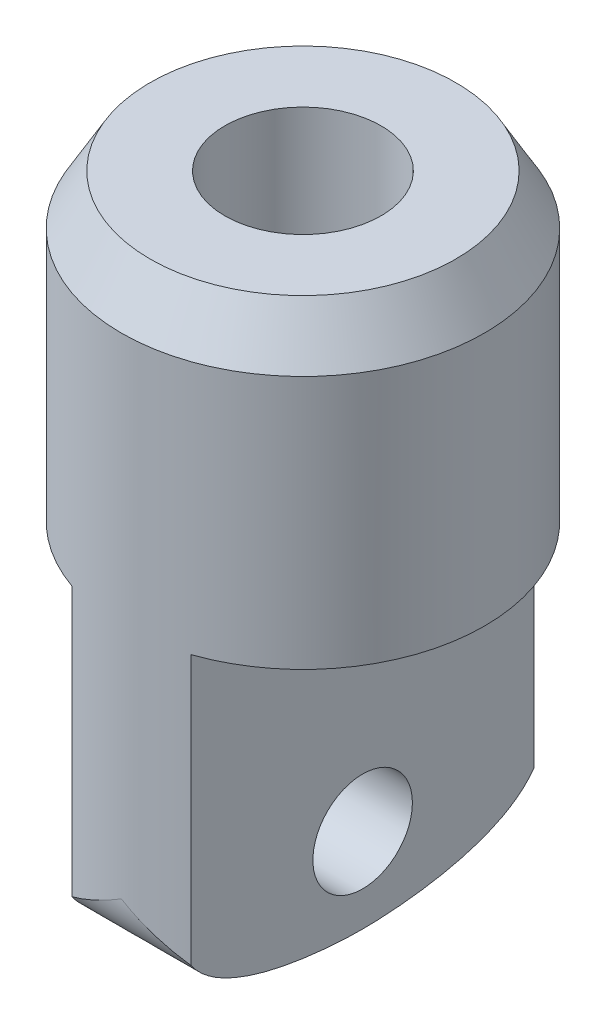
from build123d import *

# Parameters (mm, degrees)
SKETCH3_R                           = 4.6355
BOSS_EXTRUDE1_DEPTH                 = 8.001
SKETCH4_R                           = 1.9939
CUT_EXTRUDE1_DEPTH                  = 5.588
CHAMFER1_SIZE                       = 1.27
CHAMFER1_SIZE2                      = 0.733234842
CUT_EXTRUDE2_REACH                  = 12.344
CUT_EXTRUDE2_END_RADIUS             = 4.6355
SKETCH5_W                           = 3.887671843
SKETCH5_H                           = 8.255
CUT_EXTRUDE2_DIRECTION_2_REACH      = 12.344
CUT_EXTRUDE2_DIRECTION_2_END_RADIUS = 4.6355
CUT_EXTRUDE3_REACH                  = 13.111
CUT_EXTRUDE4_REACH                  = 13.111
SKETCH7_R                           = 1.27


with BuildPart() as part:
    # Sketch3 → Boss-Extrude1 (new, symmetric)
    with BuildSketch(Plane(origin=(0, 0, 0), x_dir=(1, 0, 0), z_dir=(0, 1, 0))):
        with Locations(Location((0, 0, 0), (0, 0, 270))):
            Circle(SKETCH3_R)
    extrude(amount=BOSS_EXTRUDE1_DEPTH, both=True)

    # Sketch4 → Cut-Extrude1 (cut)
    with BuildSketch(Plane(origin=(0, 8.001, 0), x_dir=(1, 0, 0), z_dir=(0, 1, 0))):
        with Locations(Location((0, 0, 0), (0, 0, 270))):
            Circle(SKETCH4_R)
    extrude(amount=-CUT_EXTRUDE1_DEPTH, mode=Mode.SUBTRACT)

    # Chamfer1
    chamfer1_edges = [part.edges().sort_by_distance(p)[0] for p in [
        (0, 8.001, -4.6355),
    ]]
    chamfer1_side = [part.faces().sort_by_distance(p)[0] for p in [
        (0, 0, -4.6355),
    ]]
    chamfer(chamfer1_edges, length=CHAMFER1_SIZE, length2=CHAMFER1_SIZE2, reference=chamfer1_side[0])

    # Cut-Extrude2: up to this cylinder (the profile starts inside it)
    cut_extrude2_end = Plane(origin=(0, -3.8735, 0), z_dir=(0, -1, 0)) * Cylinder(CUT_EXTRUDE2_END_RADIUS, 34.959, mode=Mode.PRIVATE)
    # Sketch5 → Cut-Extrude2 (cut, up to the surface)
    with BuildSketch(Plane.XY, mode=Mode.PRIVATE) as cut_extrude2_sk1:
        with Locations((-3.467835922, -3.8735)):
            Rectangle(SKETCH5_W, SKETCH5_H)
    cut_extrude2_tool1 = extrude(cut_extrude2_sk1.sketch, amount=-CUT_EXTRUDE2_REACH, mode=Mode.PRIVATE) & cut_extrude2_end
    add(cut_extrude2_tool1.solids().sort_by_distance((-3.467836, -3.8735, 0))[0], mode=Mode.SUBTRACT)
    # Sketch5 → Cut-Extrude2 (cut, up to the surface)
    with BuildSketch(Plane.XY, mode=Mode.PRIVATE) as cut_extrude2_sk2:
        with Locations((3.467835922, -3.8735)):
            Rectangle(SKETCH5_W, SKETCH5_H)
    cut_extrude2_tool2 = extrude(cut_extrude2_sk2.sketch, amount=-CUT_EXTRUDE2_REACH, mode=Mode.PRIVATE) & cut_extrude2_end
    add(cut_extrude2_tool2.solids().sort_by_distance((3.467836, -3.8735, 0))[0], mode=Mode.SUBTRACT)

    # Cut-Extrude2 direction 2: up to this cylinder (the profile starts inside it)
    cut_extrude2_direction_2_end = Plane(origin=(0, -3.8735, 0), z_dir=(0, -1, 0)) * Cylinder(CUT_EXTRUDE2_DIRECTION_2_END_RADIUS, 34.959, mode=Mode.PRIVATE)
    # Sketch5 → Cut-Extrude2 direction 2 (cut, up to the surface)
    with BuildSketch(Plane.XY, mode=Mode.PRIVATE) as cut_extrude2_direction_2_sk1:
        with Locations((-3.467835922, -3.8735)):
            Rectangle(SKETCH5_W, SKETCH5_H)
    cut_extrude2_direction_2_tool1 = extrude(cut_extrude2_direction_2_sk1.sketch, amount=CUT_EXTRUDE2_DIRECTION_2_REACH, mode=Mode.PRIVATE) & cut_extrude2_direction_2_end
    add(cut_extrude2_direction_2_tool1.solids().sort_by_distance((-3.467836, -3.8735, 0))[0], mode=Mode.SUBTRACT)
    # Sketch5 → Cut-Extrude2 direction 2 (cut, up to the surface)
    with BuildSketch(Plane.XY, mode=Mode.PRIVATE) as cut_extrude2_direction_2_sk2:
        with Locations((3.467835922, -3.8735)):
            Rectangle(SKETCH5_W, SKETCH5_H)
    cut_extrude2_direction_2_tool2 = extrude(cut_extrude2_direction_2_sk2.sketch, amount=CUT_EXTRUDE2_DIRECTION_2_REACH, mode=Mode.PRIVATE) & cut_extrude2_direction_2_end
    add(cut_extrude2_direction_2_tool2.solids().sort_by_distance((3.467836, -3.8735, 0))[0], mode=Mode.SUBTRACT)

    # Sketch6 → Cut-Extrude3 (cut, up to next)
    with BuildSketch(Plane(origin=(1.524, 0, 0), x_dir=(0, 0, -1), z_dir=(1, 0, 0)), mode=Mode.PRIVATE) as cut_extrude3_sk1:
        with BuildLine():
            add(Edge.make_bspline(
                [(-4.377817293, -6.618376883), (-3.503121267, -7.894799124), (-0.664999949, -8.001), (0, -8.001)],
                knots=[0.156984914, 0.156984914, 0.156984914, 0.156984914, 1, 1, 1, 1], degree=3))
            Line((-4.377817293, -6.618376883), (-4.377817293, -8.001))
            Line((-4.377817293, -8.001), (0, -8.001))
        make_face()
    cut_extrude3_tool1 = extrude(cut_extrude3_sk1.sketch, amount=-CUT_EXTRUDE3_REACH, mode=Mode.PRIVATE) & part.part
    # Sketch6 → Cut-Extrude3 (cut, up to next)
    with BuildSketch(Plane(origin=(1.524, 0, 0), x_dir=(0, 0, -1), z_dir=(1, 0, 0)), mode=Mode.PRIVATE) as cut_extrude3_sk2:
        with BuildLine():
            add(Edge.make_bspline(
                [(4.377817293, -6.618376883), (3.503121267, -7.894799124), (0.664999949, -8.001), (0, -8.001)],
                knots=[0.156984914, 0.156984914, 0.156984914, 0.156984914, 1, 1, 1, 1], degree=3))
            Line((0, -8.001), (4.377817293, -8.001))
            Line((4.377817293, -8.001), (4.377817293, -6.618376883))
        make_face()
    cut_extrude3_tool2 = extrude(cut_extrude3_sk2.sketch, amount=-CUT_EXTRUDE3_REACH, mode=Mode.PRIVATE) & part.part
    # Sketch6 → Cut-Extrude3 (cut, up to next)
    with BuildSketch(Plane(origin=(1.524, 0, 0), x_dir=(0, 0, -1), z_dir=(1, 0, 0)), mode=Mode.PRIVATE) as cut_extrude3_sk3:
        with BuildLine():
            add(Edge.make_bspline(
                [(-4.6355, -5.776685713), (-4.6355, -6.102410184), (-4.54070178, -6.380683586), (-4.377817293, -6.618376883)],
                knots=[0, 0, 0, 0, 0.156984914, 0.156984914, 0.156984914, 0.156984914], degree=3))
            Line((-4.6355, -5.776685713), (-4.6355, -8.001))
            Line((-4.6355, -8.001), (-4.377817293, -8.001))
            Line((-4.377817293, -8.001), (-4.377817293, -6.618376883))
        make_face()
    cut_extrude3_tool3 = extrude(cut_extrude3_sk3.sketch, amount=-CUT_EXTRUDE3_REACH, mode=Mode.PRIVATE) & part.part
    # Sketch6 → Cut-Extrude3 (cut, up to next)
    with BuildSketch(Plane(origin=(1.524, 0, 0), x_dir=(0, 0, -1), z_dir=(1, 0, 0)), mode=Mode.PRIVATE) as cut_extrude3_sk4:
        with BuildLine():
            Line((4.6355, -8.001), (4.6355, -5.776685713))
            add(Edge.make_bspline(
                [(4.6355, -5.776685713), (4.6355, -6.102410184), (4.54070178, -6.380683586), (4.377817293, -6.618376883)],
                knots=[0, 0, 0, 0, 0.156984914, 0.156984914, 0.156984914, 0.156984914], degree=3))
            Line((4.377817293, -6.618376883), (4.377817293, -8.001))
            Line((4.377817293, -8.001), (4.6355, -8.001))
        make_face()
    cut_extrude3_tool4 = extrude(cut_extrude3_sk4.sketch, amount=-CUT_EXTRUDE3_REACH, mode=Mode.PRIVATE) & part.part
    add(cut_extrude3_tool1.solids().sort_by_distance((1.524, -7.641566, 3.372722))[0], mode=Mode.SUBTRACT)
    add(cut_extrude3_tool2.solids().sort_by_distance((1.524, -7.641566, -3.372722))[0], mode=Mode.SUBTRACT)
    add(cut_extrude3_tool3.solids().sort_by_distance((1.524, -7.165384, 4.5152))[0], mode=Mode.SUBTRACT)
    add(cut_extrude3_tool4.solids().sort_by_distance((1.524, -7.165384, -4.5152))[0], mode=Mode.SUBTRACT)

    # Sketch7 → Cut-Extrude4 (cut, up to next)
    with BuildSketch(Plane(origin=(1.524, 0, 0), x_dir=(0, 0, -1), z_dir=(1, 0, 0)), mode=Mode.PRIVATE) as cut_extrude4_sk1:
        with Locations((0, -5.842)):
            Circle(SKETCH7_R)
    cut_extrude4_tool1 = extrude(cut_extrude4_sk1.sketch, amount=-CUT_EXTRUDE4_REACH, mode=Mode.PRIVATE) & part.part
    add(cut_extrude4_tool1.solids().sort_by_distance((1.524, -5.842, 0))[0], mode=Mode.SUBTRACT)


solid = part.part
